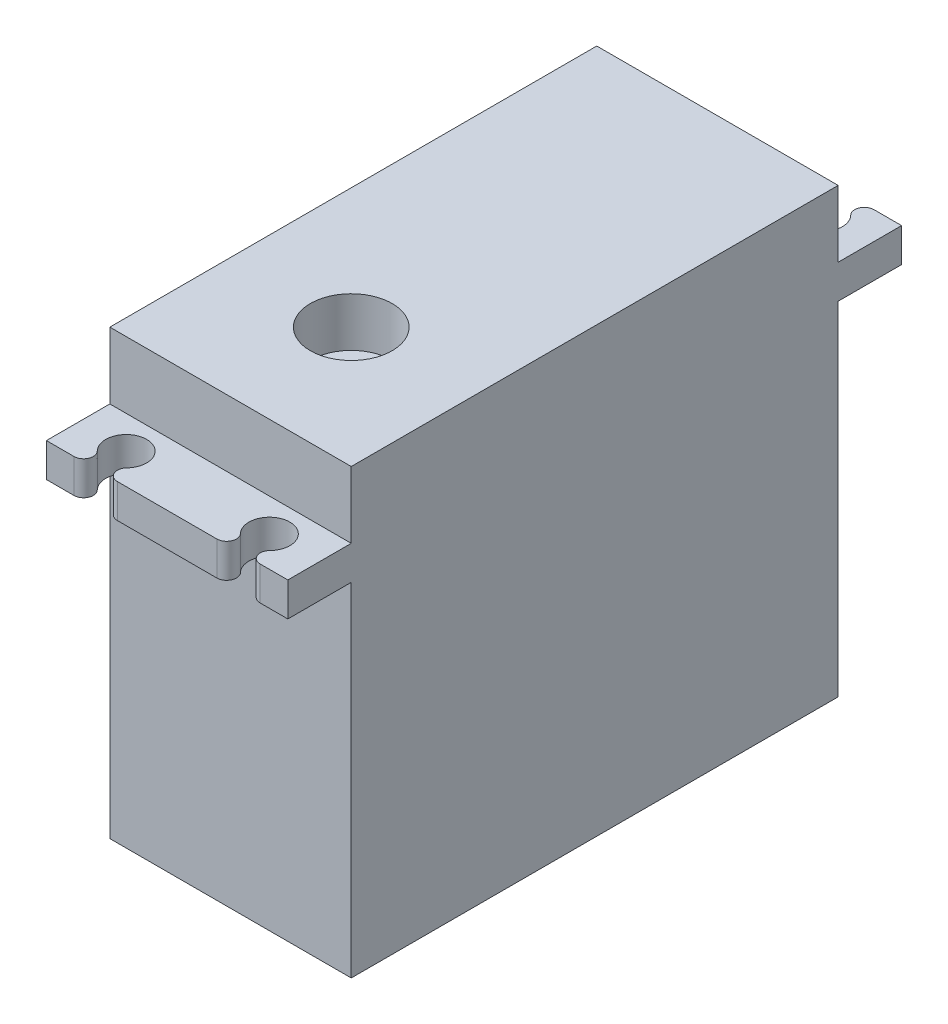
from build123d import *

# Parameters (mm, degrees)
SKETCH1_W           = 29.5
SKETCH1_H           = 59.5
BOSS_EXTRUDE1_DEPTH = 54.13
SKETCH2_W           = 29.5
SKETCH2_H           = 4.13
BOSS_EXTRUDE2_DEPTH = 7.75
CUT_EXTRUDE1_REACH  = 63.154
SKETCH4_R           = 5
CUT_EXTRUDE2_DEPTH  = 6


with BuildPart() as part:
    # Sketch1 → Boss-Extrude1 (new body)
    with BuildSketch(Plane(origin=(0, 0, 0), x_dir=(1, 0, 0), z_dir=(0, 1, 0))):
        Rectangle(SKETCH1_W, SKETCH1_H)
    extrude(amount=BOSS_EXTRUDE1_DEPTH)

    # Sketch2 → Boss-Extrude2 (add)
    with BuildSketch(Plane.XY.offset(29.75)):
        with Locations((0, 43.935)):
            Rectangle(SKETCH2_W, SKETCH2_H)
    boss_extrude2 = extrude(amount=BOSS_EXTRUDE2_DEPTH)

    # Sketch3 → Cut-Extrude1 (cut, up to next)
    with BuildSketch(Plane(origin=(0, 46, 0), x_dir=(1, 0, 0), z_dir=(0, 1, 0)), mode=Mode.PRIVATE) as cut_extrude1_sk1:
        with BuildLine():
            Line((6.079499649, -37.5), (11.375967158, -37.5))
            ThreePointArc((11.375967158, -37.5), (10.291171064, -36.779125945), (10.535567481, -35.49978535))
            ThreePointArc((10.535567481, -35.49978535), (8.765101817, -31.250045613), (6.943423266, -35.478085792))
            ThreePointArc((6.943423266, -35.478085792), (7.178874595, -36.774215218), (6.079499649, -37.5))
        make_face()
    cut_extrude1_tool1 = extrude(cut_extrude1_sk1.sketch, amount=-CUT_EXTRUDE1_REACH, mode=Mode.PRIVATE) & part.part
    # Sketch3 → Cut-Extrude1 (cut, up to next)
    with BuildSketch(Plane(origin=(0, 46, 0), x_dir=(1, 0, 0), z_dir=(0, 1, 0)), mode=Mode.PRIVATE) as cut_extrude1_sk2:
        with BuildLine():
            Line((-6.079499649, -37.5), (-11.375967158, -37.5))
            ThreePointArc((-11.375967158, -37.5), (-10.291171064, -36.779125945), (-10.535567481, -35.49978535))
            ThreePointArc((-10.535567481, -35.49978535), (-8.765101817, -31.250045613), (-6.943423266, -35.478085792))
            ThreePointArc((-6.943423266, -35.478085792), (-7.178874595, -36.774215218), (-6.079499649, -37.5))
        make_face()
    cut_extrude1_tool2 = extrude(cut_extrude1_sk2.sketch, amount=-CUT_EXTRUDE1_REACH, mode=Mode.PRIVATE) & part.part
    cut_extrude1_1 = cut_extrude1_tool1.solids().sort_by_distance((8.746301, 46, 34.352944))[0]
    add(cut_extrude1_1, mode=Mode.SUBTRACT)
    cut_extrude1_2 = cut_extrude1_tool2.solids().sort_by_distance((-8.746301, 46, 34.352944))[0]
    add(cut_extrude1_2, mode=Mode.SUBTRACT)
    cut_extrude1 = cut_extrude1_1 + cut_extrude1_2  # Cut-Extrude1 as one shape, for the pattern or mirror that repeats it

    # Mirror2: Boss-Extrude2, Cut-Extrude1 across plane
    add(boss_extrude2.mirror(Plane.XY))
    add(cut_extrude1.mirror(Plane.XY), mode=Mode.SUBTRACT)

    # Sketch4 → Cut-Extrude2 (cut)
    with BuildSketch(Plane(origin=(0, 54.13, 0), x_dir=(1, 0, 0), z_dir=(0, 1, 0))):
        with Locations(Location((0, -15, 0), (0, 0, 270))):
            Circle(SKETCH4_R)
    extrude(amount=-CUT_EXTRUDE2_DEPTH, mode=Mode.SUBTRACT)


solid = part.part
